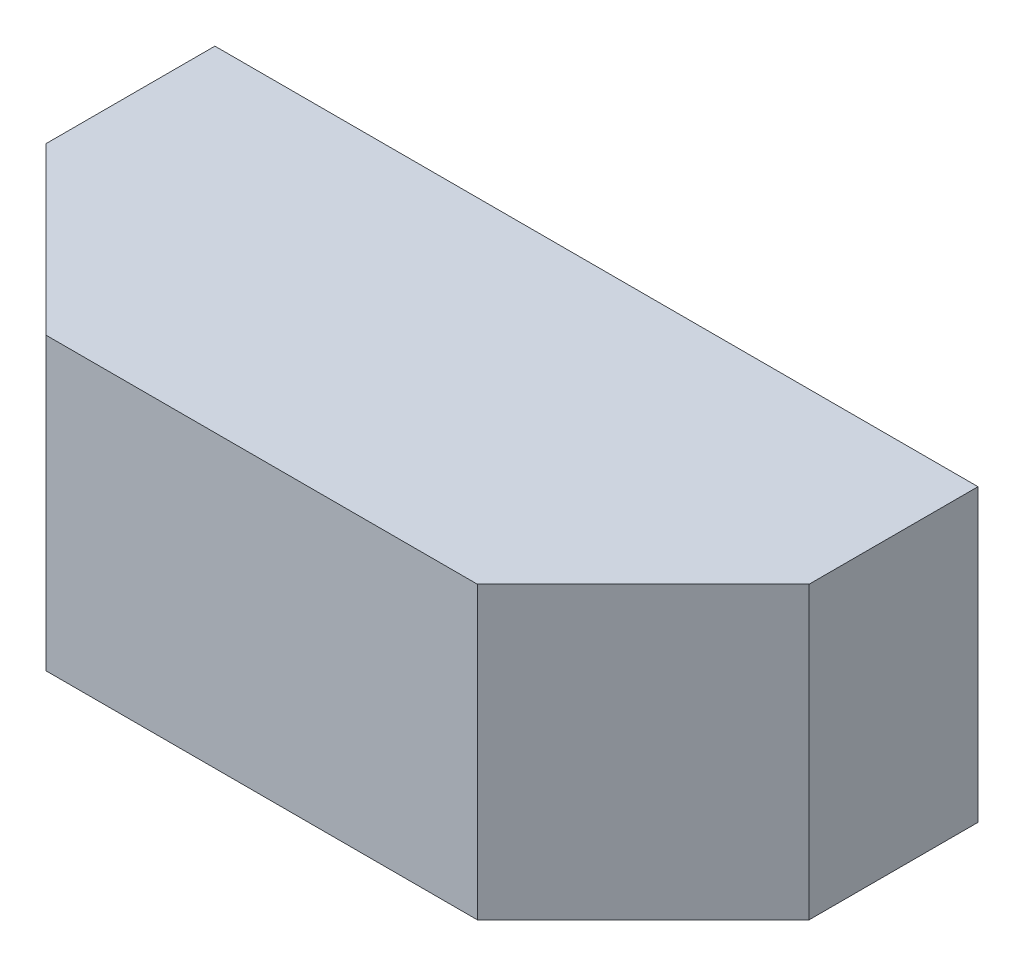
from build123d import *

# Parameters (mm, degrees)
RESSALTO_EXTRUS_O1_DEPTH = 10.16


with BuildPart() as part:
    # Esboço1 → Ressalto-extrusão1 (new body)
    with BuildSketch(Plane(origin=(0, 0, 0), x_dir=(1, 0, 0), z_dir=(0, 1, 0))):
        Polygon((20.873449302, 0), (26.67, 5.8), (26.67, 11.7), (0, 11.7), (0, 5.796550698), (5.8, 0), align=None)
    extrude(amount=RESSALTO_EXTRUS_O1_DEPTH)


solid = part.part
